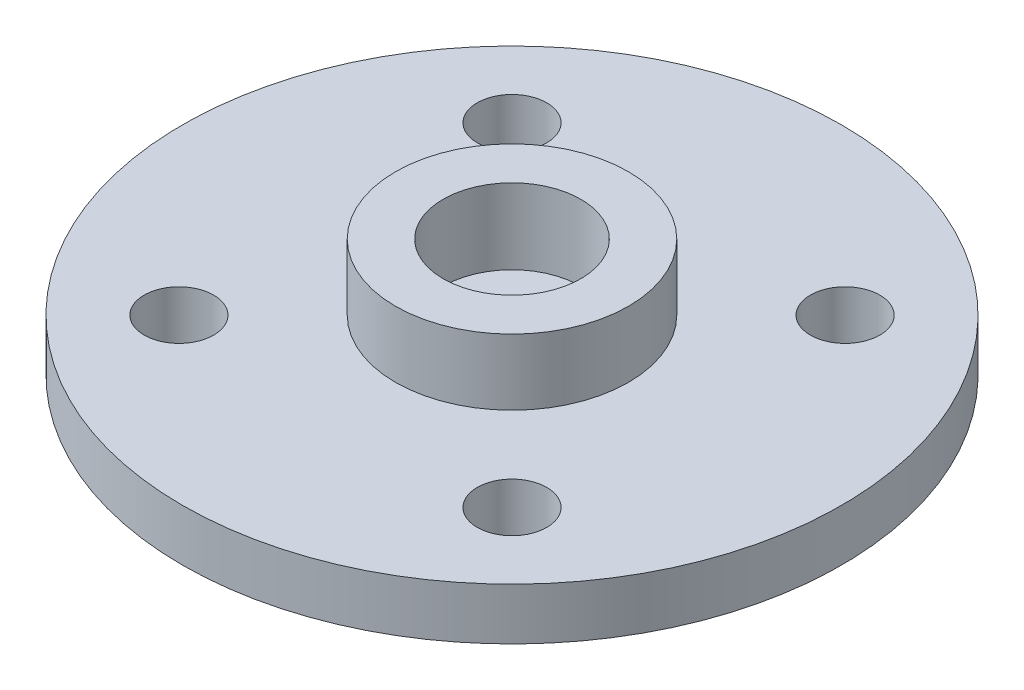
from build123d import *

# Parameters (mm, degrees)
SKETCH_1_R          = 14
SKETCH_1_R_2        = 1.475
SKETCH_1_R_3        = 4.95
EXTRUDE_1_DEPTH     = 2.2
SKETCH_1_3_R        = 4.95
SKETCH_1_3_R_2      = 1.5
EXTRUDE_2_DEPTH     = 5
SKETCH_2_R          = 2.925
CUT_EXTRUDE_1_DEPTH = 3.2
CUT_EXTRUDE_2_DEPTH = 1


with BuildPart() as part:
    # 스케치1 → 보스-돌출1 (new body)
    with BuildSketch(Plane(origin=(0, 0, 0), x_dir=(1, 0, 0), z_dir=(0, 1, 0))):
        Circle(SKETCH_1_R)
        with Locations((-7.075, -7.075)):
            Circle(SKETCH_1_R_2, mode=Mode.SUBTRACT)
        with Locations((7.075, -7.075)):
            Circle(SKETCH_1_R_2, mode=Mode.SUBTRACT)
        with Locations((-7.075, 7.075)):
            Circle(SKETCH_1_R_2, mode=Mode.SUBTRACT)
        Circle(SKETCH_1_R_3, mode=Mode.SUBTRACT)
        with Locations((7.075, 7.075)):
            Circle(SKETCH_1_R_2, mode=Mode.SUBTRACT)
    extrude(amount=EXTRUDE_1_DEPTH)

    # 스케치1<3> → 보스-돌출2 (add)
    with BuildSketch(Plane(origin=(0, 0, 0), x_dir=(1, 0, 0), z_dir=(0, 1, 0))):
        Circle(SKETCH_1_3_R)
        Circle(SKETCH_1_3_R_2, mode=Mode.SUBTRACT)
    extrude(amount=EXTRUDE_2_DEPTH)

    # 스케치2 → 컷-돌출1 (cut)
    with BuildSketch(Plane(origin=(0, 5, 0), x_dir=(1, 0, 0), z_dir=(0, 1, 0))):
        Circle(SKETCH_2_R)
    extrude(amount=-CUT_EXTRUDE_1_DEPTH, mode=Mode.SUBTRACT)

    # 스케치3 → 컷-돌출2 (cut)
    with BuildSketch(Plane.XZ):
        Polygon((0.707106781, 0.707106781), (-0.707106781, -0.707106781), (-2.828427125, 1.414213562), (-1.414213562, 2.828427125), align=None)
    extrude(amount=-CUT_EXTRUDE_2_DEPTH, mode=Mode.SUBTRACT)


solid = part.part
